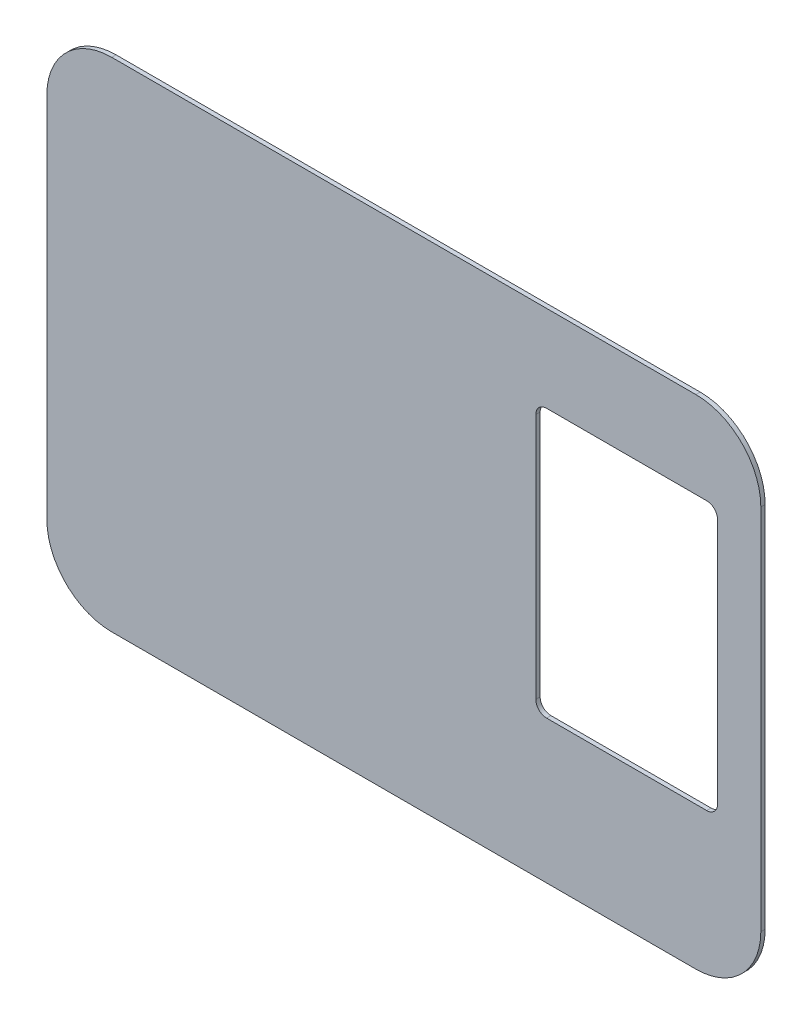
from build123d import *

# Parameters (mm, degrees)
SKETCH1_W           = 330
SKETCH1_H           = 230
BOSS_EXTRUDE1_DEPTH = 2
CUT_EXTRUDE1_DEPTH  = 2
FILLET1_R           = 30


with BuildPart() as part:
    # Sketch1 → Boss-Extrude1 (new body)
    with BuildSketch(Plane.XY):
        Rectangle(SKETCH1_W, SKETCH1_H)
    extrude(amount=BOSS_EXTRUDE1_DEPTH)

    # Sketch2 → Cut-Extrude1 (cut)
    with BuildSketch(Plane(origin=(0, 0, 0), x_dir=(-1, 0, 0), z_dir=(0, 0, -1))):
        with BuildLine():
            Line((-140, 75), (-66, 75))
            ThreePointArc((-66, 75), (-62.464466094, 73.535533906), (-61, 70))
            Line((-61, 70), (-61, -44))
            ThreePointArc((-61, -44), (-62.464466094, -47.535533906), (-66, -49))
            Line((-66, -49), (-140, -49))
            ThreePointArc((-140, -49), (-143.535533906, -47.535533906), (-145, -44))
            Line((-145, -44), (-145, 70))
            ThreePointArc((-145, 70), (-143.535533906, 73.535533906), (-140, 75))
        make_face()
    extrude(amount=-CUT_EXTRUDE1_DEPTH, mode=Mode.SUBTRACT)

    # Fillet1
    fillet1_edges = [part.edges().sort_by_distance(p)[0] for p in [
        (165, -115, 1),
        (-165, -115, 1),
        (-165, 115, 1),
        (165, 115, 1),
    ]]
    fillet(fillet1_edges, radius=FILLET1_R)


solid = part.part
